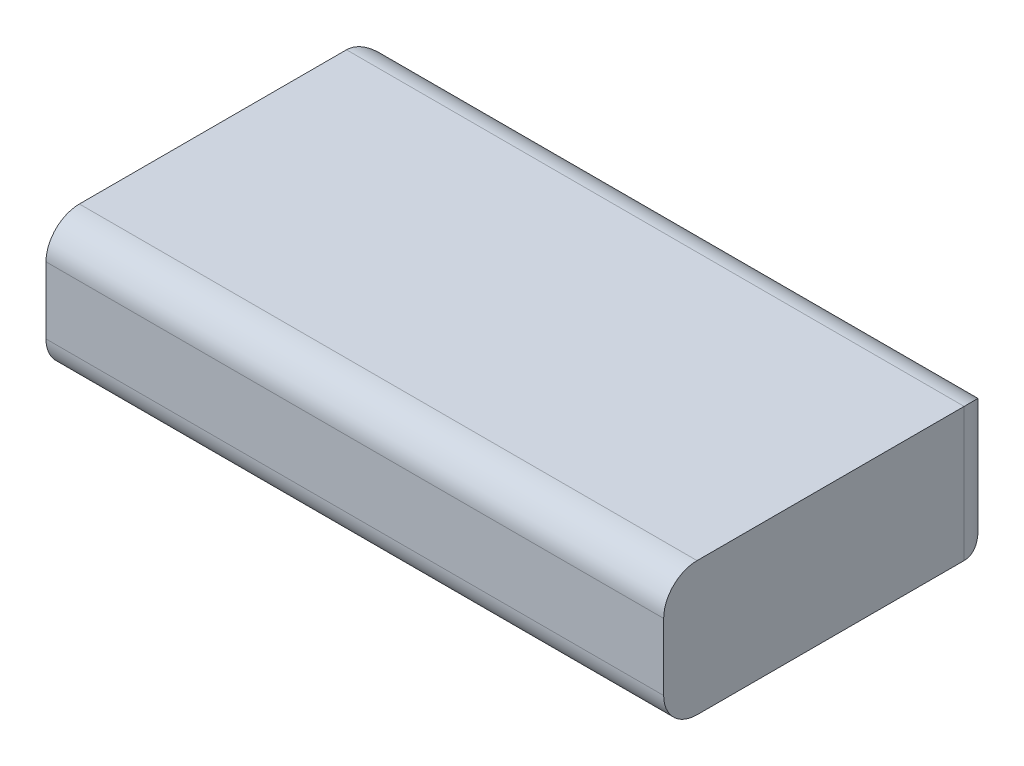
from build123d import *

# Parameters (mm, degrees)
SKETCH1_W           = 37
SKETCH1_H           = 20
BOSS_EXTRUDE1_DEPTH = 8
FILLET1_R           = 2
FILLET2_R           = 2


with BuildPart() as part:
    # Sketch1 → Boss-Extrude1 (new body)
    with BuildSketch(Plane(origin=(0, 0, 0), x_dir=(1, 0, 0), z_dir=(0, 1, 0))):
        with Locations((18.5, 10)):
            Rectangle(SKETCH1_W, SKETCH1_H)
    extrude(amount=BOSS_EXTRUDE1_DEPTH)

    # Fillet1
    fillet1_edges = [part.edges().sort_by_distance(p)[0] for p in [
        (18.5, 8, 0),
    ]]
    fillet(fillet1_edges, radius=FILLET1_R)

    # Fillet2
    fillet2_edges = [part.edges().sort_by_distance(p)[0] for p in [
        (18.5, 8, -20),
        (18.5, 0, -20),
        (18.5, 0, 0),
        (0, 4, -20),
        (37, 4, -20),
    ]]
    fillet(fillet2_edges, radius=FILLET2_R)


solid = part.part
